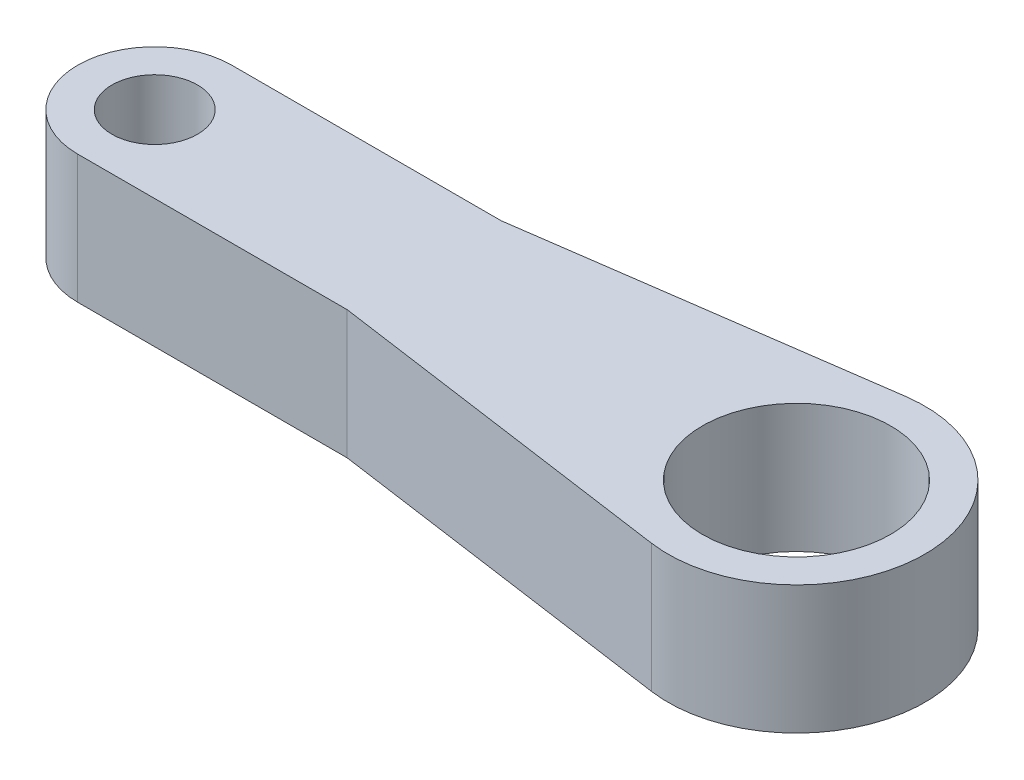
from build123d import *

# Parameters (mm, degrees)
SKETCH2_R           = 11
SKETCH2_R_2         = 5
BOSS_EXTRUDE2_DEPTH = 15


with BuildPart() as part:
    # Sketch2 → Boss-Extrude2 (new body)
    with BuildSketch(Plane(origin=(0, 0, 0), x_dir=(1, 0, 0), z_dir=(0, 1, 0))):
        with BuildLine():
            Line((-43.5, 9), (-75, 9))
            ThreePointArc((-75, 9), (-84, 0), (-75, -9))
            Line((-75, -9), (-43.5, -9))
            Line((-43.5, -9), (-2.099515649, -14.852341029))
            ThreePointArc((-2.099515649, -14.852341029), (15, 0), (-2.099515649, 14.852341029))
            Line((-2.099515649, 14.852341029), (-43.5, 9))
        make_face()
        Circle(SKETCH2_R, mode=Mode.SUBTRACT)
        with Locations((-75, 0)):
            Circle(SKETCH2_R_2, mode=Mode.SUBTRACT)
    extrude(amount=BOSS_EXTRUDE2_DEPTH)


solid = part.part
